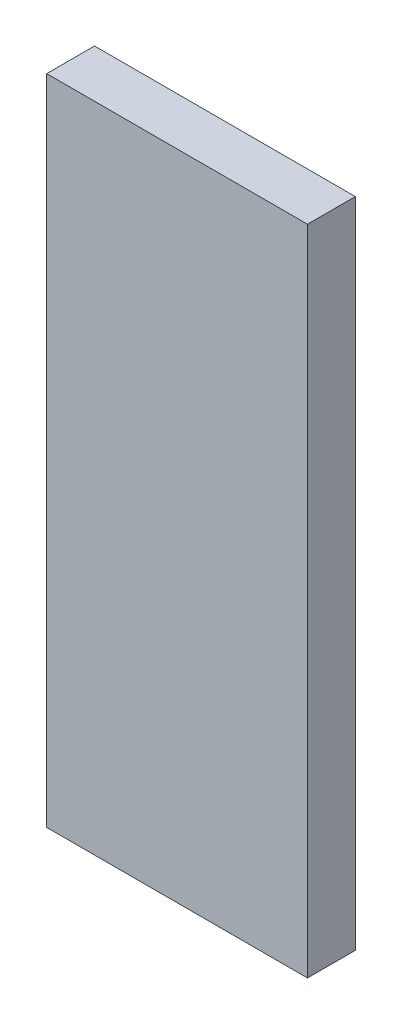
from build123d import *

# Parameters (mm, degrees)
SKETCH1_W           = 27.686
SKETCH1_H           = 69.3
BOSS_EXTRUDE1_DEPTH = 5.08


with BuildPart() as part:
    # Sketch1 → Boss-Extrude1 (new body)
    with BuildSketch(Plane.XY):
        with Locations((13.843, 34.65)):
            Rectangle(SKETCH1_W, SKETCH1_H)
    extrude(amount=BOSS_EXTRUDE1_DEPTH)


solid = part.part
